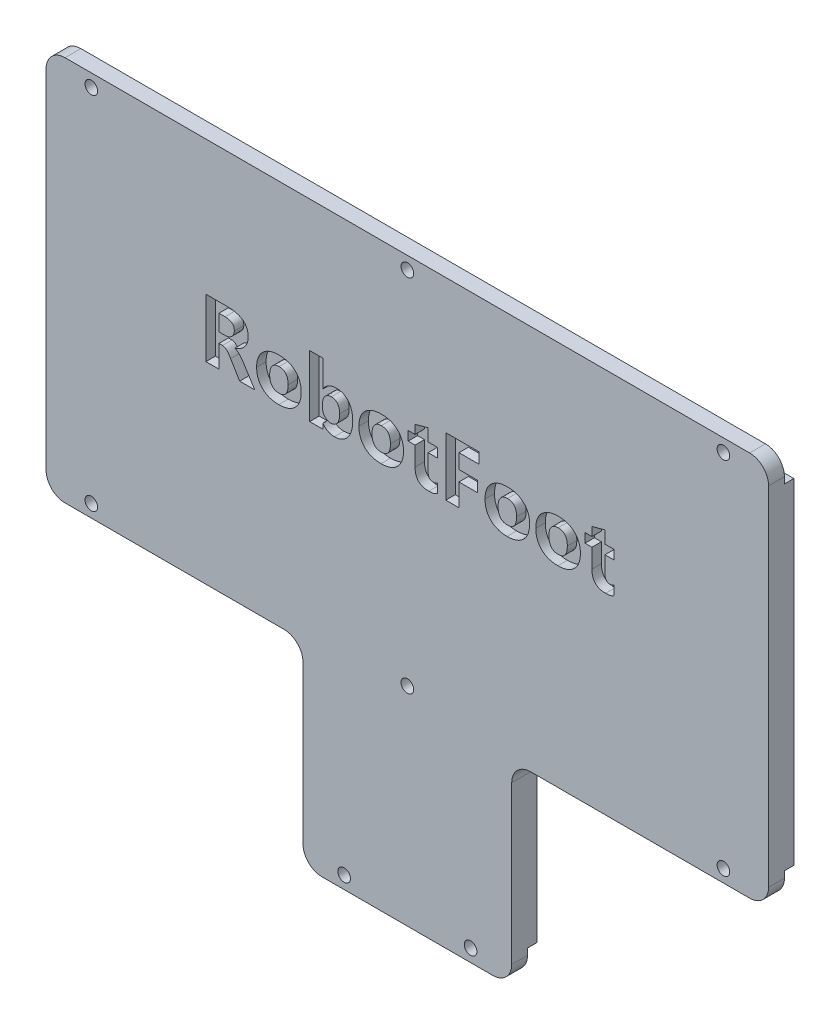
from build123d import *

# Parameters (mm, degrees)
ESQUISSE1_W              = 114.3
ESQUISSE1_H              = 61
ESQUISSE1_W_2            = 33.02
ESQUISSE1_H_2            = 30.9
BOSS_EXTRU_1_DEPTH       = 4
ENL_V_MAT_EXTRU_1_DEPTH  = 1.5
CONG_9_R                 = 3
ENL_V_MAT_EXTRU_8_REACH  = 85.977
ESQUISSE1_9_R            = 1
ESQUISSE1_10_R           = 1
ESQUISSE1_10_W           = 33.02
ESQUISSE1_10_H           = 4
ESQUISSE1_10_W_2         = 114.3
ENL_V_MAT_EXTRU_10_DEPTH = 1.5


with BuildPart() as part:
    # Esquisse1 → Boss.-Extru.1 (new body)
    with BuildSketch(Plane.XY):
        Rectangle(ESQUISSE1_W, ESQUISSE1_H)
        with Locations((0, -45.95)):
            Rectangle(ESQUISSE1_W_2, ESQUISSE1_H_2)
    extrude(amount=BOSS_EXTRU_1_DEPTH)

    # Esquisse2 → Enlèv. mat.-Extru.1 (cut)
    # profile 1 of 9: a face of its own
    with BuildSketch(Plane.XY.offset(4)):
        with BuildLine():
            Line((-24.141350796, 0), (-26.521269788, 0))
            Line((-26.521269788, 0), (-27.960246367, 2.370414523))
            add(Edge.make_bspline(
                [(-27.960246367, 2.370414523), (-28.012074272, 2.456443842), (-28.110797315, 2.620314564), (-28.263925687, 2.847140558), (-28.410154862, 3.047954317), (-28.56294954, 3.214441218), (-28.718434712, 3.350807425), (-28.88309199, 3.450328549), (-29.059165019, 3.516644389), (-29.1825661, 3.524213778), (-29.245250551, 3.528058825)],
                knots=[0, 0, 0, 0, 1.332930138, 2.538997484, 3.632432041, 4.626536682, 5.53336953, 6.367123323, 7.170542291, 8, 8, 8, 8], degree=3))
            Line((-29.245250551, 3.528058825), (-29.806014212, 3.528058825))
            Line((-29.806014212, 3.528058825), (-29.806014212, 0))
            Line((-29.806014212, 0), (-31.874186626, 0))
            Line((-31.874186626, 0), (-31.874186626, 9.245947266))
            Line((-31.874186626, 9.245947266), (-28.560928796, 9.245947266))
            add(Edge.make_bspline(
                [(-28.560928796, 9.245947266), (-28.424631216, 9.244442713), (-28.160542731, 9.241527511), (-27.777267297, 9.21001389), (-27.420286855, 9.162061159), (-27.089315967, 9.093477235), (-26.784190619, 9.007232715), (-26.504821184, 8.899349068), (-26.253482888, 8.769146871), (-26.025262974, 8.623404951), (-25.82786867, 8.452586699), (-25.65356285, 8.265234451), (-25.508972703, 8.055647421), (-25.388315489, 7.828205742), (-25.293963368, 7.580693311), (-25.231487313, 7.312678136), (-25.189816106, 7.02573615), (-25.185345278, 6.827534504), (-25.183040579, 6.725362135)],
                knots=[0, 0, 0, 0, 1.361163414, 2.63737318, 3.83860341, 4.957025206, 6.010731745, 7.002734282, 7.942541982, 8.834341987, 9.700714025, 10.542865278, 11.38389793, 12.236121028, 13.109515984, 14.02137192, 14.980023012, 16, 16, 16, 16], degree=3))
            add(Edge.make_bspline(
                [(-25.183040579, 6.725362135), (-25.184719509, 6.646052103), (-25.188021457, 6.490073231), (-25.218513692, 6.260820294), (-25.261773638, 6.039859222), (-25.330395536, 5.830281653), (-25.412011592, 5.630003863), (-25.508351296, 5.438845985), (-25.624424182, 5.259598904), (-25.752830838, 5.088278466), (-25.897319984, 4.928590325), (-26.056917166, 4.781965494), (-26.227978051, 4.64380853), (-26.414737869, 4.519829311), (-26.612096221, 4.403906399), (-26.824150478, 4.307248572), (-27.044771891, 4.217728435), (-27.198207427, 4.171277979), (-27.275924612, 4.147750192)],
                knots=[0, 0, 0, 0, 1.061644339, 2.087933671, 3.093201225, 4.07281636, 5.03571069, 5.988340973, 6.93471374, 7.891982106, 8.853304485, 9.81410231, 10.792209183, 11.794894341, 12.813824142, 13.854053526, 14.913048929, 16, 16, 16, 16], degree=3))
            Line((-27.275924612, 4.147750192), (-27.275924612, 4.121137679))
            add(Edge.make_bspline(
                [(-27.275924612, 4.121137679), (-27.207442854, 4.095894829), (-27.066468739, 4.043930793), (-26.874640338, 3.91192948), (-26.68606296, 3.756356399), (-26.506468193, 3.573453963), (-26.331171159, 3.3747434), (-26.169209859, 3.160630954), (-26.014149035, 2.944709594), (-25.9181768, 2.797831118), (-25.871164121, 2.725881657)],
                knots=[0, 0, 0, 0, 0.866466515, 1.783677192, 2.754179689, 3.779152048, 4.833103729, 5.909767363, 6.976084744, 8, 8, 8, 8], degree=3))
            Line((-25.871164121, 2.725881657), (-24.141350796, 0))
        make_face()
        with BuildLine():
            Line((-29.806014212, 7.664403654), (-29.806014212, 5.109602436))
            Line((-29.806014212, 5.109602436), (-28.887882524, 5.109602436))
            add(Edge.make_bspline(
                [(-28.887882524, 5.109602436), (-28.83204422, 5.110383969), (-28.723190173, 5.111907528), (-28.565278831, 5.132803418), (-28.414388348, 5.159453896), (-28.273771022, 5.204080475), (-28.139588432, 5.257429252), (-28.01491607, 5.323996704), (-27.897658001, 5.401598924), (-27.827802728, 5.462975881), (-27.792967716, 5.493582976)],
                knots=[0, 0, 0, 0, 1.126501625, 2.196059897, 3.212255227, 4.215889946, 5.168571389, 6.124340393, 7.064657247, 8, 8, 8, 8], degree=3))
            add(Edge.make_bspline(
                [(-27.792967716, 5.493582976), (-27.7592974, 5.526495087), (-27.693049405, 5.591251276), (-27.607381707, 5.698640024), (-27.534470089, 5.811228671), (-27.475293396, 5.929827811), (-27.428773671, 6.054641278), (-27.398011702, 6.185683824), (-27.374892532, 6.321566951), (-27.373551091, 6.414146046), (-27.372870194, 6.461137902)],
                knots=[0, 0, 0, 0, 1.038734263, 2.043760479, 3.025539117, 3.995283241, 4.964623642, 5.958783332, 6.963906911, 8, 8, 8, 8], degree=3))
            add(Edge.make_bspline(
                [(-27.372870194, 6.461137902), (-27.373862292, 6.509982787), (-27.375775801, 6.604192449), (-27.393400977, 6.741020694), (-27.421595025, 6.868389977), (-27.460833627, 6.987726897), (-27.515251208, 7.095789174), (-27.577517547, 7.196857166), (-27.654718077, 7.285427136), (-27.740828588, 7.367316744), (-27.840343685, 7.436522493), (-27.949995673, 7.498734576), (-28.071623468, 7.549068193), (-28.204683002, 7.590843561), (-28.348617363, 7.625808224), (-28.505360182, 7.646648446), (-28.672717126, 7.66356205), (-28.788352368, 7.664117377), (-28.847963755, 7.664403654)],
                knots=[0, 0, 0, 0, 1.076288324, 2.075893093, 3.03485934, 3.949149289, 4.836147295, 5.696348316, 6.558361719, 7.418109048, 8.309494901, 9.222503733, 10.192694621, 11.204230469, 12.295101603, 13.452608735, 14.686788537, 16, 16, 16, 16], degree=3))
            Line((-28.847963755, 7.664403654), (-29.806014212, 7.664403654))
        make_face(mode=Mode.SUBTRACT)
    # profile 2 of 9: a face of its own
    with BuildSketch(Plane.XY.offset(4)):
        with BuildLine():
            add(Edge.make_bspline(
                [(-20.349067738, -0.121657201), (-20.481643651, -0.11963439), (-20.739961755, -0.115693035), (-21.115439555, -0.069725295), (-21.469837552, -0.001517354), (-21.801587, 0.100518691), (-22.113487619, 0.227589607), (-22.404547582, 0.383428048), (-22.67126742, 0.571214782), (-22.915453713, 0.78455891), (-23.134187386, 1.022238022), (-23.325061767, 1.281509625), (-23.486525757, 1.562032703), (-23.616439793, 1.86291431), (-23.721072569, 2.183274841), (-23.791244173, 2.524460388), (-23.836338285, 2.885619915), (-23.841940316, 3.13316526), (-23.844811369, 3.260032804)],
                knots=[0, 0, 0, 0, 1.15514687, 2.250750859, 3.292914374, 4.297675992, 5.271172078, 6.225196592, 7.169189294, 8.108710682, 9.046964576, 9.979444345, 10.909893064, 11.862268968, 12.831791872, 13.842609061, 14.894332305, 16, 16, 16, 16], degree=3))
            add(Edge.make_bspline(
                [(-23.844811369, 3.260032804), (-23.842018576, 3.390693815), (-23.836564178, 3.645878184), (-23.790406787, 4.017556645), (-23.714349407, 4.366748655), (-23.610704125, 4.695189334), (-23.472091162, 5.000111444), (-23.307311921, 5.286256045), (-23.107615104, 5.547075812), (-22.880967038, 5.785770823), (-22.62747854, 5.997861094), (-22.353416186, 6.185662808), (-22.055927731, 6.342472303), (-21.737309153, 6.468496983), (-21.398886402, 6.571349635), (-21.03743227, 6.639119781), (-20.655663646, 6.685041156), (-20.393565601, 6.689082396), (-20.259725731, 6.691146047)],
                knots=[0, 0, 0, 0, 1.115751186, 2.179091232, 3.192905475, 4.165082731, 5.114671168, 6.048489315, 6.979401423, 7.913470479, 8.854522245, 9.797237816, 10.74628628, 11.72014936, 12.720130776, 13.762451347, 14.857400028, 16, 16, 16, 16], degree=3))
            add(Edge.make_bspline(
                [(-20.259725731, 6.691146047), (-20.127779484, 6.68913902), (-19.870716974, 6.685228857), (-19.49656061, 6.638980959), (-19.143292918, 6.57132648), (-18.812930067, 6.468854467), (-18.503212693, 6.342422116), (-18.215278246, 6.185447353), (-17.95078585, 5.99827802), (-17.708341018, 5.784977819), (-17.492955309, 5.547517612), (-17.30227086, 5.29208059), (-17.145215887, 5.015760146), (-17.011934581, 4.723940175), (-16.912017132, 4.411670398), (-16.839576685, 4.082106253), (-16.79795342, 3.733783334), (-16.791828362, 3.495852924), (-16.788693719, 3.37408643)],
                knots=[0, 0, 0, 0, 1.166509706, 2.272636921, 3.330105866, 4.344263107, 5.326874289, 6.285058595, 7.238328556, 8.187436899, 9.135684223, 10.069509202, 11.001111105, 11.941857683, 12.902563316, 13.895352984, 14.922897293, 16, 16, 16, 16], degree=3))
            add(Edge.make_bspline(
                [(-16.788693719, 3.37408643), (-16.791644166, 3.242804871), (-16.797405342, 2.986458496), (-16.841419901, 2.612306202), (-16.915144991, 2.259001471), (-17.019043611, 1.926652599), (-17.155932233, 1.616600631), (-17.318534166, 1.325824603), (-17.514644378, 1.058526818), (-17.737157387, 0.812781801), (-17.985737934, 0.591845525), (-18.259688625, 0.401583784), (-18.553501134, 0.238539334), (-18.870978634, 0.107640859), (-19.208989857, 0.002011814), (-19.570540502, -0.068150501), (-19.952539766, -0.113220758), (-20.214603094, -0.11879636), (-20.349067738, -0.121657201)],
                knots=[0, 0, 0, 0, 1.115339493, 2.177862876, 3.195812691, 4.17833242, 5.130647633, 6.070939244, 7.003553867, 7.941221333, 8.883314728, 9.822819866, 10.769884927, 11.732810252, 12.735885913, 13.773843747, 14.857759645, 16, 16, 16, 16], degree=3))
        make_face()
        with BuildLine():
            add(Edge.make_bspline(
                [(-20.293941819, 5.109602436), (-20.351060812, 5.108266745), (-20.46260673, 5.105658316), (-20.624127542, 5.081794616), (-20.777037925, 5.046641322), (-20.918819641, 4.992865521), (-21.051915616, 4.926117972), (-21.174427045, 4.843597024), (-21.287235124, 4.745834475), (-21.389942116, 4.633548269), (-21.48078948, 4.507405025), (-21.561920056, 4.369952408), (-21.62731179, 4.218716127), (-21.683476282, 4.056356227), (-21.724354005, 3.880367413), (-21.754242065, 3.692344754), (-21.774111493, 3.492363468), (-21.775782153, 3.355126638), (-21.776638955, 3.284744423)],
                knots=[0, 0, 0, 0, 1.02792987, 2.007412514, 2.934520297, 3.847976234, 4.730773182, 5.610541658, 6.500389342, 7.412989716, 8.344161015, 9.295252671, 10.281160828, 11.305919437, 12.385252435, 13.529517639, 14.733007614, 16, 16, 16, 16], degree=3))
            add(Edge.make_bspline(
                [(-21.776638955, 3.284744423), (-21.775530696, 3.211220916), (-21.773377861, 3.068398733), (-21.757204804, 2.861150442), (-21.725521338, 2.668505204), (-21.687574375, 2.489156277), (-21.633596458, 2.324603361), (-21.569052457, 2.174651167), (-21.495262384, 2.036594423), (-21.405366813, 1.915841975), (-21.305535891, 1.807876671), (-21.194802456, 1.713080239), (-21.070047204, 1.636313539), (-20.935817928, 1.56971842), (-20.788288868, 1.521618773), (-20.630017353, 1.484958507), (-20.459849263, 1.464497765), (-20.342782695, 1.461453228), (-20.282536456, 1.45988641)],
                knots=[0, 0, 0, 0, 1.308360589, 2.541539741, 3.694535816, 4.780531384, 5.80029832, 6.770031117, 7.683391958, 8.578688321, 9.440337936, 10.29643682, 11.162941666, 12.04038122, 12.956729747, 13.916778478, 14.927906879, 16, 16, 16, 16], degree=3))
            add(Edge.make_bspline(
                [(-20.282536456, 1.45988641), (-20.224828098, 1.461489639), (-20.112819263, 1.46460142), (-19.949972411, 1.484524417), (-19.79919216, 1.523224946), (-19.659271227, 1.575160462), (-19.528339719, 1.638248448), (-19.41217847, 1.722573485), (-19.304386387, 1.817454504), (-19.209076963, 1.928122001), (-19.127405769, 2.054627982), (-19.052125862, 2.192717955), (-18.992014549, 2.34831856), (-18.943703064, 2.517850678), (-18.902421261, 2.700993218), (-18.877908489, 2.899622688), (-18.859692197, 3.112059164), (-18.857826103, 3.258720902), (-18.856866134, 3.334167661)],
                knots=[0, 0, 0, 0, 1.031025062, 2.001164454, 2.923577459, 3.804572192, 4.665115232, 5.509880938, 6.359636801, 7.226410366, 8.108567745, 9.045383019, 10.031177699, 11.080676968, 12.192997088, 13.38079287, 14.652609123, 16, 16, 16, 16], degree=3))
            add(Edge.make_bspline(
                [(-18.856866134, 3.334167661), (-18.857924501, 3.40579721), (-18.859978895, 3.544837086), (-18.876788117, 3.746220014), (-18.906242559, 3.933845727), (-18.941979454, 4.10888732), (-18.994549975, 4.268476377), (-19.054231907, 4.415556667), (-19.13028178, 4.546487602), (-19.211746971, 4.667555878), (-19.309739029, 4.77101652), (-19.415489358, 4.86344541), (-19.535222909, 4.939467638), (-19.664960929, 5.003036438), (-19.807151677, 5.050003754), (-19.959371907, 5.083793757), (-20.122893974, 5.105282605), (-20.235578419, 5.108128463), (-20.293941819, 5.109602436)],
                knots=[0, 0, 0, 0, 1.316203789, 2.554878732, 3.709252269, 4.8054946, 5.832850698, 6.793016317, 7.715886598, 8.610636471, 9.467538207, 10.326336445, 11.185450359, 12.065533713, 12.975011732, 13.929796643, 14.927765885, 16, 16, 16, 16], degree=3))
        make_face(mode=Mode.SUBTRACT)
    # profile 3 of 9: a face of its own
    with BuildSketch(Plane.XY.offset(4)):
        with BuildLine():
            Line((-13.357580476, 0.832591468), (-13.382292095, 0.832591468))
            Line((-13.382292095, 0.832591468), (-13.382292095, 0))
            Line((-13.382292095, 0), (-15.45046451, 0))
            Line((-15.45046451, 0), (-15.45046451, 9.732576069))
            Line((-15.45046451, 9.732576069), (-13.382292095, 9.732576069))
            Line((-13.382292095, 9.732576069), (-13.382292095, 5.512591914))
            Line((-13.382292095, 5.512591914), (-13.357580476, 5.512591914))
            add(Edge.make_bspline(
                [(-13.357580476, 5.512591914), (-13.29448299, 5.606116344), (-13.171342915, 5.788637172), (-12.953985465, 6.029210892), (-12.719523659, 6.236079039), (-12.462257261, 6.40142759), (-12.187201847, 6.534134577), (-11.890729323, 6.623340891), (-11.575486005, 6.680738508), (-11.358735168, 6.687618225), (-11.247588399, 6.691146047)],
                knots=[0, 0, 0, 0, 1.067954715, 2.084203865, 3.063100715, 4.022410021, 4.973187602, 5.947488189, 6.947500912, 8, 8, 8, 8], degree=3))
            add(Edge.make_bspline(
                [(-11.247588399, 6.691146047), (-11.146090045, 6.688649007), (-10.94797314, 6.683774976), (-10.659595431, 6.644162532), (-10.390021627, 6.5744832), (-10.136716784, 6.482798176), (-9.903287959, 6.359012048), (-9.686163518, 6.210718054), (-9.490377649, 6.031503237), (-9.310697326, 5.829384999), (-9.151545336, 5.603492403), (-9.015050337, 5.355902351), (-8.895652089, 5.090904755), (-8.80149797, 4.803860351), (-8.728109035, 4.497963526), (-8.674366748, 4.172795378), (-8.644854494, 3.827681733), (-8.64010302, 3.590841923), (-8.637661261, 3.469131118)],
                knots=[0, 0, 0, 0, 1.037467351, 2.025055723, 2.967751231, 3.879858292, 4.77231534, 5.661781548, 6.560750744, 7.478522194, 8.422107584, 9.379117297, 10.365068388, 11.389326056, 12.462443117, 13.578536237, 14.755621776, 16, 16, 16, 16], degree=3))
            add(Edge.make_bspline(
                [(-8.637661261, 3.469131118), (-8.640471046, 3.337264522), (-8.645966296, 3.079365803), (-8.681440321, 2.701727965), (-8.744435987, 2.344827235), (-8.829547357, 2.006746558), (-8.940952366, 1.689542542), (-9.079416767, 1.393185633), (-9.238887213, 1.114955171), (-9.42470799, 0.860361213), (-9.629338782, 0.628653574), (-9.854742237, 0.428663329), (-10.095600214, 0.258281972), (-10.352422858, 0.116845502), (-10.628222608, 0.011972644), (-10.918828995, -0.067442564), (-11.227125298, -0.113243597), (-11.438162257, -0.118811369), (-11.546028719, -0.121657201)],
                knots=[0, 0, 0, 0, 1.218005483, 2.382119975, 3.499208467, 4.562380786, 5.598947766, 6.599174493, 7.579897572, 8.55621021, 9.505413563, 10.429827921, 11.332648014, 12.225703066, 13.12994473, 14.051315801, 15.00397697, 16, 16, 16, 16], degree=3))
            add(Edge.make_bspline(
                [(-11.546028719, -0.121657201), (-11.642492273, -0.118666671), (-11.830747021, -0.112830463), (-12.105079681, -0.069317643), (-12.360892422, 0.007287405), (-12.598834948, 0.112173), (-12.818355918, 0.246862635), (-13.01911697, 0.411753469), (-13.201991528, 0.607484877), (-13.304920973, 0.75640353), (-13.357580476, 0.832591468)],
                knots=[0, 0, 0, 0, 1.080039719, 2.107766078, 3.100048891, 4.062583086, 5.011817425, 5.974874566, 6.963930104, 8, 8, 8, 8], degree=3))
        make_face()
        with BuildLine():
            Line((-13.412706395, 3.526157931), (-13.412706395, 2.876052264))
            add(Edge.make_bspline(
                [(-13.412706395, 2.876052264), (-13.408522151, 2.778068298), (-13.40042883, 2.588544038), (-13.3321765, 2.316862117), (-13.218912556, 2.071242414), (-13.08696499, 1.891171358), (-12.962454774, 1.767179132), (-12.863002047, 1.684424876), (-12.757578612, 1.614164003), (-12.644860698, 1.558284477), (-12.526311359, 1.514439992), (-12.401537905, 1.482377844), (-12.27027458, 1.46248831), (-12.180999452, 1.460767283), (-12.135305786, 1.45988641)],
                knots=[0, 0, 0, 0, 1.650826565, 3.193090611, 4.689688148, 6.188116199, 6.928705284, 7.64983776, 8.367158895, 9.060184418, 9.76691839, 10.495300195, 11.229849874, 12, 12, 12, 12], degree=3))
            add(Edge.make_bspline(
                [(-12.135305786, 1.45988641), (-12.080068699, 1.461076111), (-11.972174489, 1.463399946), (-11.815529637, 1.489428782), (-11.667644885, 1.528383317), (-11.530156361, 1.586404271), (-11.401950919, 1.658337964), (-11.284249848, 1.747784777), (-11.175453881, 1.852759534), (-11.07663442, 1.974751604), (-10.99011322, 2.11193989), (-10.912823649, 2.261708127), (-10.849078039, 2.425682589), (-10.795474757, 2.60221276), (-10.756702599, 2.792702805), (-10.725495819, 2.995559257), (-10.709063054, 3.212871985), (-10.706930317, 3.362023798), (-10.705833676, 3.438716818)],
                knots=[0, 0, 0, 0, 0.960677137, 1.876483806, 2.756862206, 3.617250049, 4.466893739, 5.309635488, 6.183354769, 7.09296245, 8.035418469, 9.002344697, 10.022422996, 11.093756236, 12.210084828, 13.403483009, 14.664885616, 16, 16, 16, 16], degree=3))
            add(Edge.make_bspline(
                [(-10.705833676, 3.438716818), (-10.707051006, 3.502738515), (-10.709416895, 3.627165139), (-10.724167731, 3.808263186), (-10.750947274, 3.978491182), (-10.787766875, 4.137858613), (-10.839042482, 4.285829646), (-10.895837819, 4.424585422), (-10.967888037, 4.550946224), (-11.047421262, 4.667129592), (-11.136012906, 4.7730622), (-11.237991371, 4.861964614), (-11.346859018, 4.938563488), (-11.464108386, 5.003070769), (-11.592626868, 5.04971451), (-11.729640396, 5.083670962), (-11.875485594, 5.105161773), (-11.975555227, 5.10809554), (-12.026954842, 5.109602436)],
                knots=[0, 0, 0, 0, 1.274085177, 2.476193609, 3.612206776, 4.700982782, 5.725742399, 6.725767532, 7.679822368, 8.613665454, 9.525891464, 10.419096001, 11.29713071, 12.17162732, 13.073335384, 14.009134343, 14.977414776, 16, 16, 16, 16], degree=3))
            add(Edge.make_bspline(
                [(-12.026954842, 5.109602436), (-12.075793782, 5.107836067), (-12.171931693, 5.104359024), (-12.313004714, 5.086044376), (-12.447764227, 5.051672686), (-12.574866104, 5.000920224), (-12.698047201, 4.941254593), (-12.812247323, 4.863411204), (-12.92115893, 4.774406213), (-13.02145897, 4.670942526), (-13.114085735, 4.558470866), (-13.19499016, 4.435779837), (-13.261000721, 4.303790378), (-13.316205364, 4.164486298), (-13.360851064, 4.017190592), (-13.389910783, 3.860973592), (-13.410253589, 3.696505892), (-13.411875191, 3.583885276), (-13.412706395, 3.526157931)],
                knots=[0, 0, 0, 0, 0.994406001, 1.957456785, 2.889614484, 3.816493329, 4.73932563, 5.669339613, 6.622145809, 7.597978925, 8.597057441, 9.584328974, 10.582158069, 11.595206921, 12.631629408, 13.70912504, 14.825737824, 16, 16, 16, 16], degree=3))
        make_face(mode=Mode.SUBTRACT)
    # profile 4 of 9: a face of its own
    with BuildSketch(Plane.XY.offset(4)):
        with BuildLine():
            add(Edge.make_bspline(
                [(-4.168660023, -0.121657201), (-4.301235936, -0.11963439), (-4.55955404, -0.115693035), (-4.935031841, -0.069725295), (-5.289429837, -0.001517354), (-5.621179286, 0.100518691), (-5.933079904, 0.227589607), (-6.224139867, 0.383428048), (-6.490859705, 0.571214782), (-6.735045998, 0.78455891), (-6.953779671, 1.022238022), (-7.144654052, 1.281509625), (-7.306118042, 1.562032703), (-7.436032079, 1.86291431), (-7.540664854, 2.183274841), (-7.610836458, 2.524460388), (-7.65593057, 2.885619915), (-7.661532601, 3.13316526), (-7.664403654, 3.260032804)],
                knots=[0, 0, 0, 0, 1.15514687, 2.250750859, 3.292914374, 4.297675992, 5.271172078, 6.225196592, 7.169189294, 8.108710682, 9.046964576, 9.979444345, 10.909893064, 11.862268968, 12.831791872, 13.842609061, 14.894332305, 16, 16, 16, 16], degree=3))
            add(Edge.make_bspline(
                [(-7.664403654, 3.260032804), (-7.661610861, 3.390693815), (-7.656156463, 3.645878184), (-7.609999072, 4.017556645), (-7.533941692, 4.366748655), (-7.43029641, 4.695189334), (-7.291683447, 5.000111444), (-7.126904207, 5.286256045), (-6.92720739, 5.547075812), (-6.700559323, 5.785770823), (-6.447070825, 5.997861094), (-6.173008471, 6.185662808), (-5.875520016, 6.342472303), (-5.556901438, 6.468496983), (-5.218478687, 6.571349635), (-4.857024555, 6.639119781), (-4.475255932, 6.685041156), (-4.213157886, 6.689082396), (-4.079318016, 6.691146047)],
                knots=[0, 0, 0, 0, 1.115751186, 2.179091232, 3.192905475, 4.165082731, 5.114671168, 6.048489315, 6.979401423, 7.913470479, 8.854522245, 9.797237816, 10.74628628, 11.72014936, 12.720130776, 13.762451347, 14.857400028, 16, 16, 16, 16], degree=3))
            add(Edge.make_bspline(
                [(-4.079318016, 6.691146047), (-3.947371769, 6.68913902), (-3.690309259, 6.685228857), (-3.316152895, 6.638980959), (-2.962885203, 6.57132648), (-2.632522352, 6.468854467), (-2.322804978, 6.342422116), (-2.034870531, 6.185447353), (-1.770378135, 5.99827802), (-1.527933303, 5.784977819), (-1.312547594, 5.547517612), (-1.121863145, 5.29208059), (-0.964808172, 5.015760146), (-0.831526866, 4.723940175), (-0.731609417, 4.411670398), (-0.65916897, 4.082106253), (-0.617545705, 3.733783334), (-0.611420647, 3.495852924), (-0.608286004, 3.37408643)],
                knots=[0, 0, 0, 0, 1.166509706, 2.272636921, 3.330105866, 4.344263107, 5.326874289, 6.285058595, 7.238328556, 8.187436899, 9.135684223, 10.069509202, 11.001111105, 11.941857683, 12.902563316, 13.895352984, 14.922897293, 16, 16, 16, 16], degree=3))
            add(Edge.make_bspline(
                [(-0.608286004, 3.37408643), (-0.611236451, 3.242804871), (-0.616997628, 2.986458496), (-0.661012186, 2.612306202), (-0.734737276, 2.259001471), (-0.838635896, 1.926652599), (-0.975524518, 1.616600631), (-1.138126451, 1.325824603), (-1.334236663, 1.058526818), (-1.556749672, 0.812781801), (-1.805330219, 0.591845525), (-2.07928091, 0.401583784), (-2.373093419, 0.238539334), (-2.690570919, 0.107640859), (-3.028582142, 0.002011814), (-3.390132787, -0.068150501), (-3.772132051, -0.113220758), (-4.034195379, -0.11879636), (-4.168660023, -0.121657201)],
                knots=[0, 0, 0, 0, 1.115339493, 2.177862876, 3.195812691, 4.17833242, 5.130647633, 6.070939244, 7.003553867, 7.941221333, 8.883314728, 9.822819866, 10.769884927, 11.732810252, 12.735885913, 13.773843747, 14.857759645, 16, 16, 16, 16], degree=3))
        make_face()
        with BuildLine():
            add(Edge.make_bspline(
                [(-4.113534104, 5.109602436), (-4.170653097, 5.108266745), (-4.282199015, 5.105658316), (-4.443719827, 5.081794616), (-4.596630211, 5.046641322), (-4.738411926, 4.992865521), (-4.871507901, 4.926117972), (-4.99401933, 4.843597024), (-5.10682741, 4.745834475), (-5.209534401, 4.633548269), (-5.300381765, 4.507405025), (-5.381512341, 4.369952408), (-5.446904075, 4.218716127), (-5.503068567, 4.056356227), (-5.54394629, 3.880367413), (-5.573834351, 3.692344754), (-5.593703778, 3.492363468), (-5.595374438, 3.355126638), (-5.59623124, 3.284744423)],
                knots=[0, 0, 0, 0, 1.02792987, 2.007412514, 2.934520297, 3.847976234, 4.730773182, 5.610541658, 6.500389342, 7.412989716, 8.344161015, 9.295252671, 10.281160828, 11.305919437, 12.385252435, 13.529517639, 14.733007614, 16, 16, 16, 16], degree=3))
            add(Edge.make_bspline(
                [(-5.59623124, 3.284744423), (-5.595122981, 3.211220916), (-5.592970147, 3.068398733), (-5.576797089, 2.861150442), (-5.545113623, 2.668505204), (-5.50716666, 2.489156277), (-5.453188744, 2.324603361), (-5.388644742, 2.174651167), (-5.314854669, 2.036594423), (-5.224959098, 1.915841975), (-5.125128176, 1.807876671), (-5.014394742, 1.713080239), (-4.889639489, 1.636313539), (-4.755410213, 1.56971842), (-4.607881153, 1.521618773), (-4.449609638, 1.484958507), (-4.279441548, 1.464497765), (-4.162374981, 1.461453228), (-4.102128742, 1.45988641)],
                knots=[0, 0, 0, 0, 1.308360589, 2.541539741, 3.694535816, 4.780531384, 5.80029832, 6.770031117, 7.683391958, 8.578688321, 9.440337936, 10.29643682, 11.162941666, 12.04038122, 12.956729747, 13.916778478, 14.927906879, 16, 16, 16, 16], degree=3))
            add(Edge.make_bspline(
                [(-4.102128742, 1.45988641), (-4.044420383, 1.461489639), (-3.932411549, 1.46460142), (-3.769564697, 1.484524417), (-3.618784445, 1.523224946), (-3.478863513, 1.575160462), (-3.347932004, 1.638248448), (-3.231770755, 1.722573485), (-3.123978672, 1.817454504), (-3.028669248, 1.928122001), (-2.946998054, 2.054627982), (-2.871718147, 2.192717955), (-2.811606834, 2.34831856), (-2.763295349, 2.517850678), (-2.722013546, 2.700993218), (-2.697500774, 2.899622688), (-2.679284482, 3.112059164), (-2.677418388, 3.258720902), (-2.676458419, 3.334167661)],
                knots=[0, 0, 0, 0, 1.031025062, 2.001164454, 2.923577459, 3.804572192, 4.665115232, 5.509880938, 6.359636801, 7.226410366, 8.108567745, 9.045383019, 10.031177699, 11.080676968, 12.192997088, 13.38079287, 14.652609123, 16, 16, 16, 16], degree=3))
            add(Edge.make_bspline(
                [(-2.676458419, 3.334167661), (-2.677516787, 3.40579721), (-2.67957118, 3.544837086), (-2.696380402, 3.746220014), (-2.725834844, 3.933845727), (-2.761571739, 4.10888732), (-2.81414226, 4.268476377), (-2.873824192, 4.415556667), (-2.949874065, 4.546487602), (-3.031339256, 4.667555878), (-3.129331314, 4.77101652), (-3.235081643, 4.86344541), (-3.354815194, 4.939467638), (-3.484553214, 5.003036438), (-3.626743962, 5.050003754), (-3.778964192, 5.083793757), (-3.942486259, 5.105282605), (-4.055170704, 5.108128463), (-4.113534104, 5.109602436)],
                knots=[0, 0, 0, 0, 1.316203789, 2.554878732, 3.709252269, 4.8054946, 5.832850698, 6.793016317, 7.715886598, 8.610636471, 9.467538207, 10.326336445, 11.185450359, 12.065533713, 12.975011732, 13.929796643, 14.927765885, 16, 16, 16, 16], degree=3))
        make_face(mode=Mode.SUBTRACT)
    # profile 5 of 9: a face of its own
    with BuildSketch(Plane.XY.offset(4)):
        with BuildLine():
            add(Edge.make_bspline(
                [(4.744630834, 0.243314402), (4.705386281, 0.213780041), (4.625079821, 0.153343629), (4.488328384, 0.080003144), (4.337929785, 0.017516308), (4.173681189, -0.033556404), (3.995087622, -0.0736802), (3.80185775, -0.101232589), (3.594276218, -0.118656524), (3.451426104, -0.120637443), (3.377888218, -0.121657201)],
                knots=[0, 0, 0, 0, 0.817075561, 1.671988646, 2.575546237, 3.526841943, 4.533045372, 5.621098383, 6.775363977, 8, 8, 8, 8], degree=3))
            add(Edge.make_bspline(
                [(3.377888218, -0.121657201), (3.290395284, -0.119609145), (3.121385502, -0.115652924), (2.875806667, -0.091602359), (2.647430858, -0.048067547), (2.43495743, 0.013083273), (2.238102872, 0.089493425), (2.060647079, 0.18804287), (1.898256233, 0.300777694), (1.754052823, 0.431939421), (1.626604637, 0.580876146), (1.516284044, 0.746839515), (1.422915743, 0.930673501), (1.347046458, 1.131528228), (1.287884296, 1.349889448), (1.247937769, 1.585478671), (1.219371207, 1.838104257), (1.217525927, 2.012324981), (1.216572009, 2.102388502)],
                knots=[0, 0, 0, 0, 1.180467923, 2.280305589, 3.324798725, 4.312326957, 5.260016683, 6.166722689, 7.044225914, 7.921729139, 8.788675802, 9.682516048, 10.603892749, 11.564411671, 12.574330037, 13.65089892, 14.785630609, 16, 16, 16, 16], degree=3))
            Line((1.216572009, 2.102388502), (1.216572009, 5.109602436))
            Line((1.216572009, 5.109602436), (0.121657201, 5.109602436))
            Line((0.121657201, 5.109602436), (0.121657201, 6.569488847))
            Line((0.121657201, 6.569488847), (1.216572009, 6.569488847))
            Line((1.216572009, 6.569488847), (1.216572009, 7.953339506))
            Line((1.216572009, 7.953339506), (3.284744423, 8.51600406))
            Line((3.284744423, 8.51600406), (3.284744423, 6.569488847))
            Line((3.284744423, 6.569488847), (4.744630834, 6.569488847))
            Line((4.744630834, 6.569488847), (4.744630834, 5.109602436))
            Line((4.744630834, 5.109602436), (3.284744423, 5.109602436))
            Line((3.284744423, 5.109602436), (3.284744423, 2.476864574))
            add(Edge.make_bspline(
                [(3.284744423, 2.476864574), (3.287121668, 2.397490538), (3.291603179, 2.247856946), (3.328971308, 2.038821646), (3.390539245, 1.860275115), (3.479272902, 1.712332993), (3.596084835, 1.596741773), (3.739621546, 1.51527146), (3.907716224, 1.466864341), (4.0276546, 1.462291177), (4.090723379, 1.45988641)],
                knots=[0, 0, 0, 0, 1.285725981, 2.423812724, 3.427569264, 4.331129338, 5.195312492, 6.060227591, 6.97998386, 8, 8, 8, 8], degree=3))
            add(Edge.make_bspline(
                [(4.090723379, 1.45988641), (4.144248787, 1.462985835), (4.254411639, 1.469364889), (4.418837619, 1.517927404), (4.585093858, 1.595366395), (4.689794061, 1.666135477), (4.744630834, 1.703200812)],
                knots=[0, 0, 0, 0, 0.905315691, 1.863267576, 2.880885562, 4, 4, 4, 4], degree=3))
            Line((4.744630834, 1.703200812), (4.744630834, 0.243314402))
        make_face()
    # profile 6 of 9: a face of its own
    with BuildSketch(Plane.XY.offset(4)):
        Polygon((11.31411968, 7.542746454), (8.151032458, 7.542746454), (8.151032458, 5.231259637), (11.070805279, 5.231259637), (11.070805279, 3.528058825), (8.151032458, 3.528058825), (8.151032458, 0), (6.082860043, 0), (6.082860043, 9.245947266), (11.31411968, 9.245947266), align=None)
    # profile 7 of 9: a face of its own
    with BuildSketch(Plane.XY.offset(4)):
        with BuildLine():
            add(Edge.make_bspline(
                [(15.783120918, -0.121657201), (15.650545006, -0.11963439), (15.392226901, -0.115693035), (15.016749101, -0.069725295), (14.662351104, -0.001517354), (14.330601656, 0.100518691), (14.018701037, 0.227589607), (13.727641075, 0.383428048), (13.460921236, 0.571214782), (13.216734944, 0.78455891), (12.99800127, 1.022238022), (12.807126889, 1.281509625), (12.6456629, 1.562032703), (12.515748863, 1.86291431), (12.411116087, 2.183274841), (12.340944483, 2.524460388), (12.295850371, 2.885619915), (12.290248341, 3.13316526), (12.287377287, 3.260032804)],
                knots=[0, 0, 0, 0, 1.15514687, 2.250750859, 3.292914374, 4.297675992, 5.271172078, 6.225196592, 7.169189294, 8.108710682, 9.046964576, 9.979444345, 10.909893064, 11.862268968, 12.831791872, 13.842609061, 14.894332305, 16, 16, 16, 16], degree=3))
            add(Edge.make_bspline(
                [(12.287377287, 3.260032804), (12.29017008, 3.390693815), (12.295624478, 3.645878184), (12.341781869, 4.017556645), (12.417839249, 4.366748655), (12.521484532, 4.695189334), (12.660097495, 5.000111444), (12.824876735, 5.286256045), (13.024573552, 5.547075812), (13.251221619, 5.785770823), (13.504710117, 5.997861094), (13.77877247, 6.185662808), (14.076260926, 6.342472303), (14.394879503, 6.468496983), (14.733302255, 6.571349635), (15.094756387, 6.639119781), (15.47652501, 6.685041156), (15.738623056, 6.689082396), (15.872462925, 6.691146047)],
                knots=[0, 0, 0, 0, 1.115751186, 2.179091232, 3.192905475, 4.165082731, 5.114671168, 6.048489315, 6.979401423, 7.913470479, 8.854522245, 9.797237816, 10.74628628, 11.72014936, 12.720130776, 13.762451347, 14.857400028, 16, 16, 16, 16], degree=3))
            add(Edge.make_bspline(
                [(15.872462925, 6.691146047), (16.004409172, 6.68913902), (16.261471682, 6.685228857), (16.635628046, 6.638980959), (16.988895739, 6.57132648), (17.31925859, 6.468854467), (17.628975963, 6.342422116), (17.91691041, 6.185447353), (18.181402806, 5.99827802), (18.423847639, 5.784977819), (18.639233347, 5.547517612), (18.829917796, 5.29208059), (18.98697277, 5.015760146), (19.120254076, 4.723940175), (19.220171525, 4.411670398), (19.292611972, 4.082106253), (19.334235236, 3.733783334), (19.340360294, 3.495852924), (19.343494937, 3.37408643)],
                knots=[0, 0, 0, 0, 1.166509706, 2.272636921, 3.330105866, 4.344263107, 5.326874289, 6.285058595, 7.238328556, 8.187436899, 9.135684223, 10.069509202, 11.001111105, 11.941857683, 12.902563316, 13.895352984, 14.922897293, 16, 16, 16, 16], degree=3))
            add(Edge.make_bspline(
                [(19.343494937, 3.37408643), (19.340544491, 3.242804871), (19.334783314, 2.986458496), (19.290768756, 2.612306202), (19.217043666, 2.259001471), (19.113145045, 1.926652599), (18.976256424, 1.616600631), (18.813654491, 1.325824603), (18.617544278, 1.058526818), (18.395031269, 0.812781801), (18.146450723, 0.591845525), (17.872500031, 0.401583784), (17.578687523, 0.238539334), (17.261210022, 0.107640859), (16.9231988, 0.002011814), (16.561648154, -0.068150501), (16.179648891, -0.113220758), (15.917585563, -0.11879636), (15.783120918, -0.121657201)],
                knots=[0, 0, 0, 0, 1.115339493, 2.177862876, 3.195812691, 4.17833242, 5.130647633, 6.070939244, 7.003553867, 7.941221333, 8.883314728, 9.822819866, 10.769884927, 11.732810252, 12.735885913, 13.773843747, 14.857759645, 16, 16, 16, 16], degree=3))
        make_face()
        with BuildLine():
            add(Edge.make_bspline(
                [(15.838246837, 5.109602436), (15.781127845, 5.108266745), (15.669581926, 5.105658316), (15.508061115, 5.081794616), (15.355150731, 5.046641322), (15.213369015, 4.992865521), (15.08027304, 4.926117972), (14.957761612, 4.843597024), (14.844953532, 4.745834475), (14.74224654, 4.633548269), (14.651399176, 4.507405025), (14.570268601, 4.369952408), (14.504876867, 4.218716127), (14.448712375, 4.056356227), (14.407834652, 3.880367413), (14.377946591, 3.692344754), (14.358077163, 3.492363468), (14.356406504, 3.355126638), (14.355549702, 3.284744423)],
                knots=[0, 0, 0, 0, 1.02792987, 2.007412514, 2.934520297, 3.847976234, 4.730773182, 5.610541658, 6.500389342, 7.412989716, 8.344161015, 9.295252671, 10.281160828, 11.305919437, 12.385252435, 13.529517639, 14.733007614, 16, 16, 16, 16], degree=3))
            add(Edge.make_bspline(
                [(14.355549702, 3.284744423), (14.356657961, 3.211220916), (14.358810795, 3.068398733), (14.374983853, 2.861150442), (14.406667318, 2.668505204), (14.444614281, 2.489156277), (14.498592198, 2.324603361), (14.563136199, 2.174651167), (14.636926273, 2.036594423), (14.726821843, 1.915841975), (14.826652765, 1.807876671), (14.9373862, 1.713080239), (15.062141453, 1.636313539), (15.196370728, 1.56971842), (15.343899789, 1.521618773), (15.502171304, 1.484958507), (15.672339394, 1.464497765), (15.789405961, 1.461453228), (15.8496522, 1.45988641)],
                knots=[0, 0, 0, 0, 1.308360589, 2.541539741, 3.694535816, 4.780531384, 5.80029832, 6.770031117, 7.683391958, 8.578688321, 9.440337936, 10.29643682, 11.162941666, 12.04038122, 12.956729747, 13.916778478, 14.927906879, 16, 16, 16, 16], degree=3))
            add(Edge.make_bspline(
                [(15.8496522, 1.45988641), (15.907360558, 1.461489639), (16.019369393, 1.46460142), (16.182216245, 1.484524417), (16.332996497, 1.523224946), (16.472917429, 1.575160462), (16.603848937, 1.638248448), (16.720010186, 1.722573485), (16.82780227, 1.817454504), (16.923111694, 1.928122001), (17.004782887, 2.054627982), (17.080062794, 2.192717955), (17.140174108, 2.34831856), (17.188485593, 2.517850678), (17.229767395, 2.700993218), (17.254280167, 2.899622688), (17.272496459, 3.112059164), (17.274362553, 3.258720902), (17.275322523, 3.334167661)],
                knots=[0, 0, 0, 0, 1.031025062, 2.001164454, 2.923577459, 3.804572192, 4.665115232, 5.509880938, 6.359636801, 7.226410366, 8.108567745, 9.045383019, 10.031177699, 11.080676968, 12.192997088, 13.38079287, 14.652609123, 16, 16, 16, 16], degree=3))
            add(Edge.make_bspline(
                [(17.275322523, 3.334167661), (17.274264155, 3.40579721), (17.272209761, 3.544837086), (17.25540054, 3.746220014), (17.225946098, 3.933845727), (17.190209203, 4.10888732), (17.137638681, 4.268476377), (17.07795675, 4.415556667), (17.001906877, 4.546487602), (16.920441685, 4.667555878), (16.822449627, 4.77101652), (16.716699299, 4.86344541), (16.596965747, 4.939467638), (16.467227727, 5.003036438), (16.32503698, 5.050003754), (16.17281675, 5.083793757), (16.009294683, 5.105282605), (15.896610237, 5.108128463), (15.838246837, 5.109602436)],
                knots=[0, 0, 0, 0, 1.316203789, 2.554878732, 3.709252269, 4.8054946, 5.832850698, 6.793016317, 7.715886598, 8.610636471, 9.467538207, 10.326336445, 11.185450359, 12.065533713, 12.975011732, 13.929796643, 14.927765885, 16, 16, 16, 16], degree=3))
        make_face(mode=Mode.SUBTRACT)
    # profile 8 of 9: a face of its own
    with BuildSketch(Plane.XY.offset(4)):
        with BuildLine():
            add(Edge.make_bspline(
                [(23.812496175, -0.121657201), (23.679920263, -0.11963439), (23.421602158, -0.115693035), (23.046124358, -0.069725295), (22.691726361, -0.001517354), (22.359976913, 0.100518691), (22.048076294, 0.227589607), (21.757016331, 0.383428048), (21.490296493, 0.571214782), (21.246110201, 0.78455891), (21.027376527, 1.022238022), (20.836502146, 1.281509625), (20.675038157, 1.562032703), (20.54512412, 1.86291431), (20.440491344, 2.183274841), (20.37031974, 2.524460388), (20.325225628, 2.885619915), (20.319623597, 3.13316526), (20.316752544, 3.260032804)],
                knots=[0, 0, 0, 0, 1.15514687, 2.250750859, 3.292914374, 4.297675992, 5.271172078, 6.225196592, 7.169189294, 8.108710682, 9.046964576, 9.979444345, 10.909893064, 11.862268968, 12.831791872, 13.842609061, 14.894332305, 16, 16, 16, 16], degree=3))
            add(Edge.make_bspline(
                [(20.316752544, 3.260032804), (20.319545337, 3.390693815), (20.324999735, 3.645878184), (20.371157126, 4.017556645), (20.447214506, 4.366748655), (20.550859789, 4.695189334), (20.689472752, 5.000111444), (20.854251992, 5.286256045), (21.053948809, 5.547075812), (21.280596876, 5.785770823), (21.534085374, 5.997861094), (21.808147727, 6.185662808), (22.105636183, 6.342472303), (22.42425476, 6.468496983), (22.762677512, 6.571349635), (23.124131644, 6.639119781), (23.505900267, 6.685041156), (23.767998313, 6.689082396), (23.901838182, 6.691146047)],
                knots=[0, 0, 0, 0, 1.115751186, 2.179091232, 3.192905475, 4.165082731, 5.114671168, 6.048489315, 6.979401423, 7.913470479, 8.854522245, 9.797237816, 10.74628628, 11.72014936, 12.720130776, 13.762451347, 14.857400028, 16, 16, 16, 16], degree=3))
            add(Edge.make_bspline(
                [(23.901838182, 6.691146047), (24.033784429, 6.68913902), (24.290846939, 6.685228857), (24.665003303, 6.638980959), (25.018270996, 6.57132648), (25.348633847, 6.468854467), (25.65835122, 6.342422116), (25.946285667, 6.185447353), (26.210778063, 5.99827802), (26.453222896, 5.784977819), (26.668608604, 5.547517612), (26.859293053, 5.29208059), (27.016348027, 5.015760146), (27.149629333, 4.723940175), (27.249546782, 4.411670398), (27.321987229, 4.082106253), (27.363610493, 3.733783334), (27.369735551, 3.495852924), (27.372870194, 3.37408643)],
                knots=[0, 0, 0, 0, 1.166509706, 2.272636921, 3.330105866, 4.344263107, 5.326874289, 6.285058595, 7.238328556, 8.187436899, 9.135684223, 10.069509202, 11.001111105, 11.941857683, 12.902563316, 13.895352984, 14.922897293, 16, 16, 16, 16], degree=3))
            add(Edge.make_bspline(
                [(27.372870194, 3.37408643), (27.369919748, 3.242804871), (27.364158571, 2.986458496), (27.320144013, 2.612306202), (27.246418923, 2.259001471), (27.142520302, 1.926652599), (27.005631681, 1.616600631), (26.843029748, 1.325824603), (26.646919535, 1.058526818), (26.424406526, 0.812781801), (26.17582598, 0.591845525), (25.901875288, 0.401583784), (25.60806278, 0.238539334), (25.290585279, 0.107640859), (24.952574057, 0.002011814), (24.591023411, -0.068150501), (24.209024148, -0.113220758), (23.94696082, -0.11879636), (23.812496175, -0.121657201)],
                knots=[0, 0, 0, 0, 1.115339493, 2.177862876, 3.195812691, 4.17833242, 5.130647633, 6.070939244, 7.003553867, 7.941221333, 8.883314728, 9.822819866, 10.769884927, 11.732810252, 12.735885913, 13.773843747, 14.857759645, 16, 16, 16, 16], degree=3))
        make_face()
        with BuildLine():
            add(Edge.make_bspline(
                [(23.867622094, 5.109602436), (23.810503101, 5.108266745), (23.698957183, 5.105658316), (23.537436372, 5.081794616), (23.384525988, 5.046641322), (23.242744272, 4.992865521), (23.109648297, 4.926117972), (22.987136869, 4.843597024), (22.874328789, 4.745834475), (22.771621797, 4.633548269), (22.680774433, 4.507405025), (22.599643858, 4.369952408), (22.534252124, 4.218716127), (22.478087632, 4.056356227), (22.437209909, 3.880367413), (22.407321848, 3.692344754), (22.38745242, 3.492363468), (22.385781761, 3.355126638), (22.384924959, 3.284744423)],
                knots=[0, 0, 0, 0, 1.02792987, 2.007412514, 2.934520297, 3.847976234, 4.730773182, 5.610541658, 6.500389342, 7.412989716, 8.344161015, 9.295252671, 10.281160828, 11.305919437, 12.385252435, 13.529517639, 14.733007614, 16, 16, 16, 16], degree=3))
            add(Edge.make_bspline(
                [(22.384924959, 3.284744423), (22.386033218, 3.211220916), (22.388186052, 3.068398733), (22.40435911, 2.861150442), (22.436042575, 2.668505204), (22.473989538, 2.489156277), (22.527967455, 2.324603361), (22.592511456, 2.174651167), (22.66630153, 2.036594423), (22.7561971, 1.915841975), (22.856028022, 1.807876671), (22.966761457, 1.713080239), (23.09151671, 1.636313539), (23.225745985, 1.56971842), (23.373275046, 1.521618773), (23.531546561, 1.484958507), (23.701714651, 1.464497765), (23.818781218, 1.461453228), (23.879027457, 1.45988641)],
                knots=[0, 0, 0, 0, 1.308360589, 2.541539741, 3.694535816, 4.780531384, 5.80029832, 6.770031117, 7.683391958, 8.578688321, 9.440337936, 10.29643682, 11.162941666, 12.04038122, 12.956729747, 13.916778478, 14.927906879, 16, 16, 16, 16], degree=3))
            add(Edge.make_bspline(
                [(23.879027457, 1.45988641), (23.936735815, 1.461489639), (24.04874465, 1.46460142), (24.211591502, 1.484524417), (24.362371754, 1.523224946), (24.502292686, 1.575160462), (24.633224194, 1.638248448), (24.749385443, 1.722573485), (24.857177527, 1.817454504), (24.952486951, 1.928122001), (25.034158144, 2.054627982), (25.109438051, 2.192717955), (25.169549365, 2.34831856), (25.21786085, 2.517850678), (25.259142652, 2.700993218), (25.283655424, 2.899622688), (25.301871716, 3.112059164), (25.30373781, 3.258720902), (25.30469778, 3.334167661)],
                knots=[0, 0, 0, 0, 1.031025062, 2.001164454, 2.923577459, 3.804572192, 4.665115232, 5.509880938, 6.359636801, 7.226410366, 8.108567745, 9.045383019, 10.031177699, 11.080676968, 12.192997088, 13.38079287, 14.652609123, 16, 16, 16, 16], degree=3))
            add(Edge.make_bspline(
                [(25.30469778, 3.334167661), (25.303639412, 3.40579721), (25.301585018, 3.544837086), (25.284775797, 3.746220014), (25.255321355, 3.933845727), (25.21958446, 4.10888732), (25.167013938, 4.268476377), (25.107332007, 4.415556667), (25.031282134, 4.546487602), (24.949816942, 4.667555878), (24.851824884, 4.77101652), (24.746074556, 4.86344541), (24.626341004, 4.939467638), (24.496602984, 5.003036438), (24.354412237, 5.050003754), (24.202192007, 5.083793757), (24.03866994, 5.105282605), (23.925985494, 5.108128463), (23.867622094, 5.109602436)],
                knots=[0, 0, 0, 0, 1.316203789, 2.554878732, 3.709252269, 4.8054946, 5.832850698, 6.793016317, 7.715886598, 8.610636471, 9.467538207, 10.326336445, 11.185450359, 12.065533713, 12.975011732, 13.929796643, 14.927765885, 16, 16, 16, 16], degree=3))
        make_face(mode=Mode.SUBTRACT)
    # profile 9 of 9: a face of its own
    with BuildSketch(Plane.XY.offset(4)):
        with BuildLine():
            add(Edge.make_bspline(
                [(32.725787032, 0.243314402), (32.68654248, 0.213780041), (32.60623602, 0.153343629), (32.469484583, 0.080003144), (32.319085984, 0.017516308), (32.154837388, -0.033556404), (31.976243821, -0.0736802), (31.783013948, -0.101232589), (31.575432417, -0.118656524), (31.432582302, -0.120637443), (31.359044416, -0.121657201)],
                knots=[0, 0, 0, 0, 0.817075561, 1.671988646, 2.575546237, 3.526841943, 4.533045372, 5.621098383, 6.775363977, 8, 8, 8, 8], degree=3))
            add(Edge.make_bspline(
                [(31.359044416, -0.121657201), (31.271551482, -0.119609145), (31.1025417, -0.115652924), (30.856962866, -0.091602359), (30.628587056, -0.048067547), (30.416113629, 0.013083273), (30.219259071, 0.089493425), (30.041803278, 0.18804287), (29.879412432, 0.300777694), (29.735209022, 0.431939421), (29.607760835, 0.580876146), (29.497440243, 0.746839515), (29.404071942, 0.930673501), (29.328202657, 1.131528228), (29.269040494, 1.349889448), (29.229093968, 1.585478671), (29.200527406, 1.838104257), (29.198682126, 2.012324981), (29.197728207, 2.102388502)],
                knots=[0, 0, 0, 0, 1.180467923, 2.280305589, 3.324798725, 4.312326957, 5.260016683, 6.166722689, 7.044225914, 7.921729139, 8.788675802, 9.682516048, 10.603892749, 11.564411671, 12.574330037, 13.65089892, 14.785630609, 16, 16, 16, 16], degree=3))
            Line((29.197728207, 2.102388502), (29.197728207, 5.109602436))
            Line((29.197728207, 5.109602436), (28.102813399, 5.109602436))
            Line((28.102813399, 5.109602436), (28.102813399, 6.569488847))
            Line((28.102813399, 6.569488847), (29.197728207, 6.569488847))
            Line((29.197728207, 6.569488847), (29.197728207, 7.953339506))
            Line((29.197728207, 7.953339506), (31.265900622, 8.51600406))
            Line((31.265900622, 8.51600406), (31.265900622, 6.569488847))
            Line((31.265900622, 6.569488847), (32.725787032, 6.569488847))
            Line((32.725787032, 6.569488847), (32.725787032, 5.109602436))
            Line((32.725787032, 5.109602436), (31.265900622, 5.109602436))
            Line((31.265900622, 5.109602436), (31.265900622, 2.476864574))
            add(Edge.make_bspline(
                [(31.265900622, 2.476864574), (31.268277866, 2.397490538), (31.272759378, 2.247856946), (31.310127507, 2.038821646), (31.371695444, 1.860275115), (31.4604291, 1.712332993), (31.577241034, 1.596741773), (31.720777745, 1.51527146), (31.888872423, 1.466864341), (32.008810798, 1.462291177), (32.071879578, 1.45988641)],
                knots=[0, 0, 0, 0, 1.285725981, 2.423812724, 3.427569264, 4.331129338, 5.195312492, 6.060227591, 6.97998386, 8, 8, 8, 8], degree=3))
            add(Edge.make_bspline(
                [(32.071879578, 1.45988641), (32.125404986, 1.462985835), (32.235567837, 1.469364889), (32.399993818, 1.517927404), (32.566250056, 1.595366395), (32.67095026, 1.666135477), (32.725787032, 1.703200812)],
                knots=[0, 0, 0, 0, 0.905315691, 1.863267576, 2.880885562, 4, 4, 4, 4], degree=3))
            Line((32.725787032, 1.703200812), (32.725787032, 0.243314402))
        make_face()
    extrude(amount=-ENL_V_MAT_EXTRU_1_DEPTH, mode=Mode.SUBTRACT)

    # Congé9
    cong_9_edges = [part.edges().sort_by_distance(p)[0] for p in [
        (-57.15, 30.5, 2),
        (57.15, 30.5, 2),
        (57.15, -30.5, 2),
        (16.51, -30.5, 2),
        (-57.15, -30.5, 2),
        (16.51, -61.4, 2),
        (-16.51, -61.4, 2),
        (-16.51, -30.5, 2),
    ]]
    fillet(cong_9_edges, radius=CONG_9_R)

    # Esquisse1<9> → Enlèv. mat.-Extru.8 (cut, up to next)
    with BuildSketch(Plane.XY, mode=Mode.PRIVATE) as enl_v_mat_extru_8_sk1:
        with Locations((50, 28.5)):
            Circle(ESQUISSE1_9_R)
    enl_v_mat_extru_8_tool1 = extrude(enl_v_mat_extru_8_sk1.sketch, amount=ENL_V_MAT_EXTRU_8_REACH, mode=Mode.PRIVATE) & part.part
    # Esquisse1<9> → Enlèv. mat.-Extru.8 (cut, up to next)
    with BuildSketch(Plane.XY, mode=Mode.PRIVATE) as enl_v_mat_extru_8_sk2:
        with Locations((0, 28.5)):
            Circle(ESQUISSE1_9_R)
    enl_v_mat_extru_8_tool2 = extrude(enl_v_mat_extru_8_sk2.sketch, amount=ENL_V_MAT_EXTRU_8_REACH, mode=Mode.PRIVATE) & part.part
    # Esquisse1<9> → Enlèv. mat.-Extru.8 (cut, up to next)
    with BuildSketch(Plane.XY, mode=Mode.PRIVATE) as enl_v_mat_extru_8_sk3:
        with Locations((-50, 28.5)):
            Circle(ESQUISSE1_9_R)
    enl_v_mat_extru_8_tool3 = extrude(enl_v_mat_extru_8_sk3.sketch, amount=ENL_V_MAT_EXTRU_8_REACH, mode=Mode.PRIVATE) & part.part
    # Esquisse1<9> → Enlèv. mat.-Extru.8 (cut, up to next)
    with BuildSketch(Plane.XY, mode=Mode.PRIVATE) as enl_v_mat_extru_8_sk4:
        with Locations((50, -28.5)):
            Circle(ESQUISSE1_9_R)
    enl_v_mat_extru_8_tool4 = extrude(enl_v_mat_extru_8_sk4.sketch, amount=ENL_V_MAT_EXTRU_8_REACH, mode=Mode.PRIVATE) & part.part
    # Esquisse1<9> → Enlèv. mat.-Extru.8 (cut, up to next)
    with BuildSketch(Plane.XY, mode=Mode.PRIVATE) as enl_v_mat_extru_8_sk5:
        with Locations((0, -28.5)):
            Circle(ESQUISSE1_9_R)
    enl_v_mat_extru_8_tool5 = extrude(enl_v_mat_extru_8_sk5.sketch, amount=ENL_V_MAT_EXTRU_8_REACH, mode=Mode.PRIVATE) & part.part
    # Esquisse1<9> → Enlèv. mat.-Extru.8 (cut, up to next)
    with BuildSketch(Plane.XY, mode=Mode.PRIVATE) as enl_v_mat_extru_8_sk6:
        with Locations((-50, -28.5)):
            Circle(ESQUISSE1_9_R)
    enl_v_mat_extru_8_tool6 = extrude(enl_v_mat_extru_8_sk6.sketch, amount=ENL_V_MAT_EXTRU_8_REACH, mode=Mode.PRIVATE) & part.part
    # Esquisse1<9> → Enlèv. mat.-Extru.8 (cut, up to next)
    with BuildSketch(Plane.XY, mode=Mode.PRIVATE) as enl_v_mat_extru_8_sk7:
        with Locations((10, -59.4)):
            Circle(ESQUISSE1_9_R)
    enl_v_mat_extru_8_tool7 = extrude(enl_v_mat_extru_8_sk7.sketch, amount=ENL_V_MAT_EXTRU_8_REACH, mode=Mode.PRIVATE) & part.part
    # Esquisse1<9> → Enlèv. mat.-Extru.8 (cut, up to next)
    with BuildSketch(Plane.XY, mode=Mode.PRIVATE) as enl_v_mat_extru_8_sk8:
        with Locations((-10, -59.4)):
            Circle(ESQUISSE1_9_R)
    enl_v_mat_extru_8_tool8 = extrude(enl_v_mat_extru_8_sk8.sketch, amount=ENL_V_MAT_EXTRU_8_REACH, mode=Mode.PRIVATE) & part.part
    add(enl_v_mat_extru_8_tool1.solids().sort_by_distance((50, 28.5, 0))[0], mode=Mode.SUBTRACT)
    add(enl_v_mat_extru_8_tool2.solids().sort_by_distance((0, 28.5, 0))[0], mode=Mode.SUBTRACT)
    add(enl_v_mat_extru_8_tool3.solids().sort_by_distance((-50, 28.5, 0))[0], mode=Mode.SUBTRACT)
    add(enl_v_mat_extru_8_tool4.solids().sort_by_distance((50, -28.5, 0))[0], mode=Mode.SUBTRACT)
    add(enl_v_mat_extru_8_tool5.solids().sort_by_distance((0, -28.5, 0))[0], mode=Mode.SUBTRACT)
    add(enl_v_mat_extru_8_tool6.solids().sort_by_distance((-50, -28.5, 0))[0], mode=Mode.SUBTRACT)
    add(enl_v_mat_extru_8_tool7.solids().sort_by_distance((10, -59.4, 0))[0], mode=Mode.SUBTRACT)
    add(enl_v_mat_extru_8_tool8.solids().sort_by_distance((-10, -59.4, 0))[0], mode=Mode.SUBTRACT)

    # Esquisse1<10> → Enlèv. mat.-Extru.10 (cut)
    # profile 1 of 3: a face of its own
    with BuildSketch(Plane.XY):
        Polygon((57.15, -26.5), (-57.15, -26.5), (-57.15, -30.5), (-16.51, -30.5), (16.51, -30.5), (57.15, -30.5), align=None)
        with Locations((-50, -28.5)):
            Circle(ESQUISSE1_10_R, mode=Mode.SUBTRACT)
        with Locations((0, -28.5)):
            Circle(ESQUISSE1_10_R, mode=Mode.SUBTRACT)
        with Locations((50, -28.5)):
            Circle(ESQUISSE1_10_R, mode=Mode.SUBTRACT)
    # profile 2 of 3: a face of its own
    with BuildSketch(Plane.XY):
        with Locations((0, -59.4)):
            Rectangle(ESQUISSE1_10_W, ESQUISSE1_10_H)
        with Locations((-10, -59.4)):
            Circle(ESQUISSE1_10_R, mode=Mode.SUBTRACT)
        with Locations((10, -59.4)):
            Circle(ESQUISSE1_10_R, mode=Mode.SUBTRACT)
    # profile 3 of 3: a face of its own
    with BuildSketch(Plane.XY):
        with Locations((0, 28.5)):
            Rectangle(ESQUISSE1_10_W_2, ESQUISSE1_10_H)
        with Locations((-50, 28.5)):
            Circle(ESQUISSE1_10_R, mode=Mode.SUBTRACT)
        with Locations((0, 28.5)):
            Circle(ESQUISSE1_10_R, mode=Mode.SUBTRACT)
        with Locations((50, 28.5)):
            Circle(ESQUISSE1_10_R, mode=Mode.SUBTRACT)
    extrude(amount=ENL_V_MAT_EXTRU_10_DEPTH, mode=Mode.SUBTRACT)


solid = part.part
